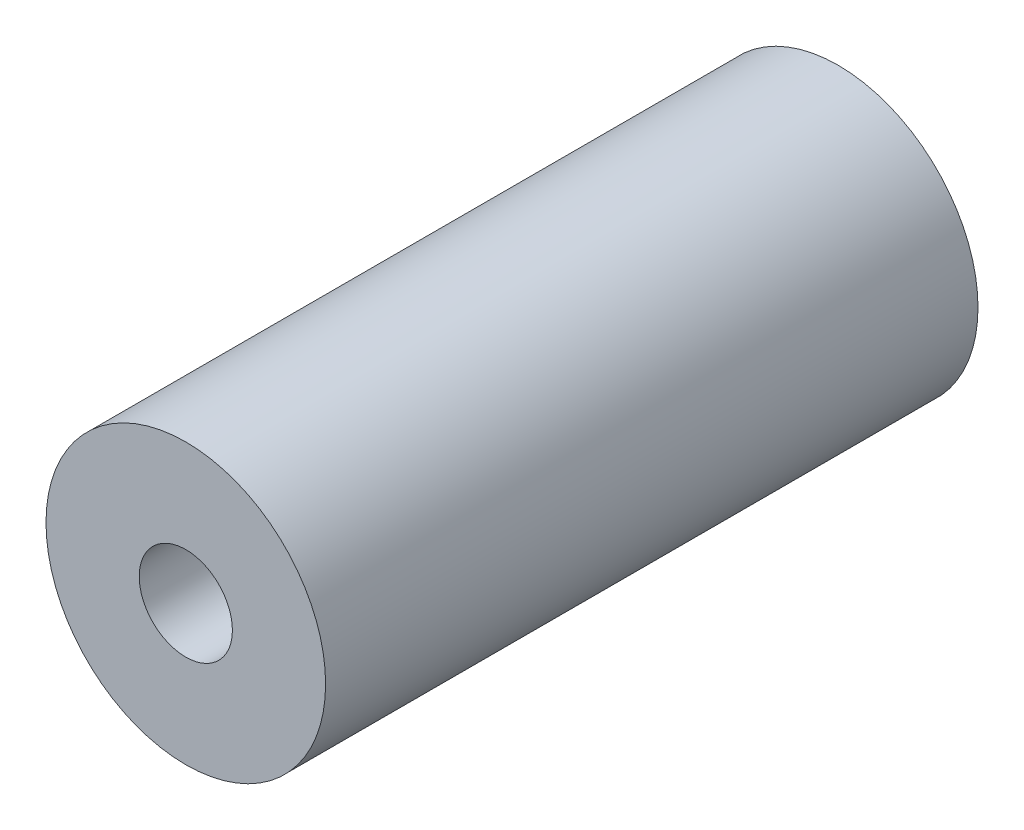
from build123d import *

# Parameters (mm, degrees)
SKETCH1_R           = 3
SKETCH1_R_2         = 1
BOSS_EXTRUDE1_DEPTH = 14


with BuildPart() as part:
    # Sketch1 → Boss-Extrude1 (new body)
    with BuildSketch(Plane.XY):
        Circle(SKETCH1_R)
        Circle(SKETCH1_R_2, mode=Mode.SUBTRACT)
    extrude(amount=BOSS_EXTRUDE1_DEPTH)


solid = part.part
